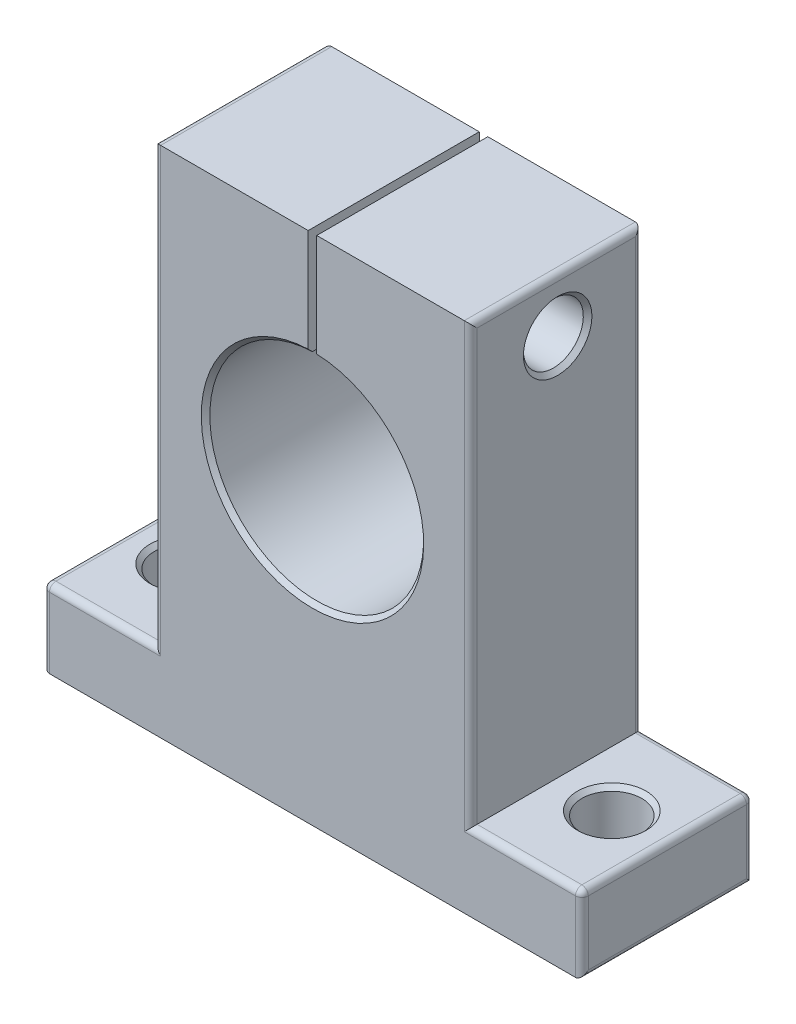
from build123d import *

# Parameters (mm, degrees)
BOSS_EXTRUDE1_DEPTH     = 20
SKETCH2_R               = 7
CUT_EXTRUDE1_DEPTH      = 122.544230632
CUT_EXTRUDE2_DEPTH      = 130.68037631
CUT_EXTRUDE2_DEPTH_BACK = 130.68037631
SKETCH5_R               = 7
CHAMFER2_SIZE           = 1
FILLET2_R               = 1.5


with BuildPart() as part:
    # Sketch1 → Boss-Extrude1 (new, symmetric)
    with BuildSketch(Plane.XY):
        with BuildLine():
            Line((-63, -9), (-63, 9))
            Line((-63, 9), (-37, 9))
            Line((-37, 9), (-37, 111))
            Line((-37, 111), (-1, 111))
            Line((-1, 111), (-1, 85.979991994))
            ThreePointArc((-1, 85.979991994), (0, 36), (1, 85.979991994))
            Line((1, 85.979991994), (1, 111))
            Line((1, 111), (37, 111))
            Line((37, 111), (37, 9))
            Line((37, 9), (63, 9))
            Line((63, 9), (63, -9))
            Line((63, -9), (-63, -9))
        make_face()
    extrude(amount=BOSS_EXTRUDE1_DEPTH, both=True)

    # Sketch2 → Cut-Extrude1 (cut, through all)
    with BuildSketch(Plane(origin=(0, 9, 0), x_dir=(1, 0, 0), z_dir=(0, 1, 0))):
        with Locations(Location((50, 0, 0), (0, 0, 180))):
            Circle(SKETCH2_R)
        with Locations((-50, 0)):
            Circle(SKETCH2_R)
    extrude(amount=-CUT_EXTRUDE1_DEPTH, mode=Mode.SUBTRACT)

    # Sketch5 → Cut-Extrude2 (cut, two sides: drawn at the far end of the back side and taken through both)
    with BuildSketch(Plane(origin=(-1, 0, 0), x_dir=(0, 0, -1), z_dir=(1, 0, 0)).offset(-CUT_EXTRUDE2_DEPTH_BACK)):
        with Locations((0.330734984, 98.489995997)):
            Circle(SKETCH5_R)
    extrude(amount=CUT_EXTRUDE2_DEPTH + CUT_EXTRUDE2_DEPTH_BACK, mode=Mode.SUBTRACT)

    # Chamfer2
    chamfer2_edges = [part.edges().sort_by_distance(p)[0] for p in [
        (0, 36, -20),
        (0, 36, 20),
        (57, 9, 0),
        (-57, 9, 0),
        (-37, 98.489995997, 6.669265016),
        (37, 98.489995997, 6.669265016),
    ]]
    chamfer(chamfer2_edges, length=CHAMFER2_SIZE)

    # Fillet2
    fillet2_edges = [part.edges().sort_by_distance(p)[0] for p in [
        (-50, 9, 20),
        (37, 60, -20),
        (50, 9, -20),
        (-63, 0, 20),
        (63, 0, -20),
        (-63, 0, -20),
        (-50, 9, -20),
        (-37, 60, -20),
        (63, 0, 20),
        (37, 111, 0),
        (63, 9, 0),
        (63, -9, 0),
        (-63, -9, 0),
        (-63, 9, 0),
        (-37, 111, 0),
        (50, 9, 20),
        (37, 60, 20),
        (-37, 60, 20),
    ]]
    fillet(fillet2_edges, radius=FILLET2_R)


solid = part.part
